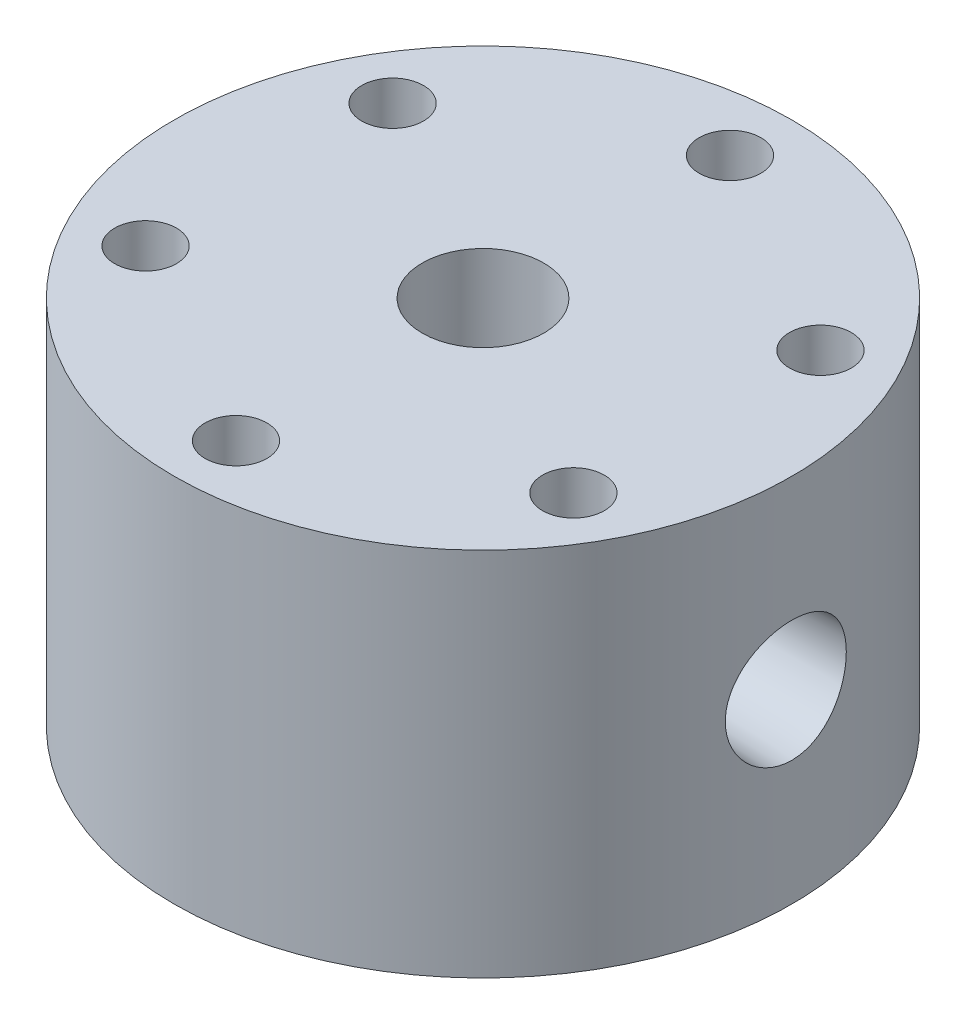
from build123d import *

# Parameters (mm, degrees)
M14X1_5_TAPPED_HOLE1_D              = 12.5
M14X1_5_TAPPED_HOLE1_DEPTH          = 25.4
M14X1_5_TAPPED_HOLE1_TIP            = 3.755378869
F_1_16_0_0625_DIAMETER_HOLE1_D      = 1.5875
F_1_16_0_0625_DIAMETER_HOLE1_DEPTH  = 28.575
F_1_16_0_0625_DIAMETER_HOLE1_TIP    = 0.476933116
F_3_32_0_09375_DIAMETER_HOLE1_D     = 2.38125
F_3_32_0_09375_DIAMETER_HOLE1_DEPTH = 28.702
F_3_32_0_09375_DIAMETER_HOLE1_TIP   = 0.715399675
F_1_4_0_25_DIAMETER_HOLE1_D         = 6.35
CIRPATTERN1_COUNT                   = 6
F_1_32_0_03125_DIAMETER_HOLE1_D     = 0.79375
F_1_32_0_03125_DIAMETER_HOLE1_DEPTH = 28.575
F_1_32_0_03125_DIAMETER_HOLE1_TIP   = 0.238466558


with BuildPart() as part:
    # Sketch1 → Revolve1 (revolve)
    with BuildSketch(Plane.XY, mode=Mode.PRIVATE) as revolve1_sk:
        Polygon((-12.7, 0), (-31.75, 0), (-31.75, 38.1), (-3.81, 38.1), (-3.81, 6.35), (-8.0645, 6.35), (-8.0645, 8.382), (-11.1125, 8.382), (-11.1125, 6.35), (-12.7, 6.35), align=None)
    revolve(revolve1_sk.sketch.rotate(Axis((0, 0, 0), (0, 1, 0)), 270), axis=Axis((0, 0, 0), (0, 1, 0)))

    # M14x1.5 Tapped Hole1
    with Locations(Plane(origin=(0, 38.1, 0), x_dir=(1, 0, 0), z_dir=(0, 1, 0))):
        with Locations((0, 0)):
            Hole(M14X1_5_TAPPED_HOLE1_D / 2, depth=M14X1_5_TAPPED_HOLE1_DEPTH)
            with Locations((0, 0, -(M14X1_5_TAPPED_HOLE1_DEPTH + M14X1_5_TAPPED_HOLE1_TIP / 2))):  # 118° drill point
                Cone(0, M14X1_5_TAPPED_HOLE1_D / 2, M14X1_5_TAPPED_HOLE1_TIP, mode=Mode.SUBTRACT)

    # Sketch6 → 1/4 NPT Tapped Hole1 (revolve, cut)
    with BuildSketch(Plane(origin=(31.75, 19.05, 0), x_dir=(0, 0, -1), z_dir=(0, 1, 0))):
        Polygon((0, 0), (0, 20.360347279), (5.5626, 17.018), (5.5626, 9.906), (5.943685794, 9.906), (6.2402847, 0), align=None)
    revolve(axis=Axis((38.1, 19.05, 0), (-1, 0, 0)), mode=Mode.SUBTRACT)

    # Sketch8 → 1/4 NPT Tapped Hole2 (revolve, cut)
    with BuildSketch(Plane(origin=(-31.75, 19.05, 0), x_dir=(0, 0, 1), z_dir=(0, 1, 0))):
        Polygon((0, 0), (0, 20.360347279), (5.5626, 17.018), (5.5626, 9.906), (5.943685794, 9.906), (6.2402847, 0), align=None)
    revolve(axis=Axis((-38.1, 19.05, 0), (1, 0, 0)), mode=Mode.SUBTRACT)

    # 1/16 (0.0625) Diameter Hole1
    with Locations(Plane(origin=(31.75, 0, 0), x_dir=(0, 0, -1), z_dir=(1, 0, 0))):
        with Locations((0, 19.05)):
            Hole(F_1_16_0_0625_DIAMETER_HOLE1_D / 2, depth=F_1_16_0_0625_DIAMETER_HOLE1_DEPTH)
            with Locations((0, 0, -(F_1_16_0_0625_DIAMETER_HOLE1_DEPTH + F_1_16_0_0625_DIAMETER_HOLE1_TIP / 2))):  # 118° drill point
                Cone(0, F_1_16_0_0625_DIAMETER_HOLE1_D / 2, F_1_16_0_0625_DIAMETER_HOLE1_TIP, mode=Mode.SUBTRACT)

    # 3/32 (0.09375) Diameter Hole1
    with Locations(Plane.ZY.offset(31.75)):
        with Locations((0, 19.05)):
            Hole(F_3_32_0_09375_DIAMETER_HOLE1_D / 2, depth=F_3_32_0_09375_DIAMETER_HOLE1_DEPTH)
            with Locations((0, 0, -(F_3_32_0_09375_DIAMETER_HOLE1_DEPTH + F_3_32_0_09375_DIAMETER_HOLE1_TIP / 2))):  # 118° drill point
                Cone(0, F_3_32_0_09375_DIAMETER_HOLE1_D / 2, F_3_32_0_09375_DIAMETER_HOLE1_TIP, mode=Mode.SUBTRACT)

    # 1/4 (0.25) Diameter Hole1 (through all)
    with Locations(Plane(origin=(0, 38.1, 0), x_dir=(1, 0, 0), z_dir=(0, 1, 0))):
        with Locations((21.997045256, 12.7)):
            f_1_4_0_25_diameter_hole1 = Hole(F_1_4_0_25_DIAMETER_HOLE1_D / 2)

    # CirPattern1: 1/4 (0.25) Diameter Hole1 ×6 about axis
    cirpattern1_axis = Axis((0, 0, 0), (0, 1, 0))
    for i in range(1, CIRPATTERN1_COUNT):
        add(f_1_4_0_25_diameter_hole1.rotate(cirpattern1_axis, i * 360 / CIRPATTERN1_COUNT), mode=Mode.SUBTRACT)

    # Sketch18 → 1/4 NPT Tapped Hole3 (revolve, cut)
    with BuildSketch(Plane(origin=(15.875, 19.05, -27.49630657), x_dir=(-0.8660254037844416, 0, -0.49999999999999495), z_dir=(0, 1, 0))):
        Polygon((0, 0), (0, 20.360347279), (5.5626, 17.018), (5.5626, 9.906), (5.943685794, 9.906), (6.2402847, 0), align=None)
    revolve(axis=Axis((19.05, 19.05, -32.995567884), (-0.49999999999999495, 0, 0.8660254037844417)), mode=Mode.SUBTRACT)

    # 1/32 (0.03125) Diameter Hole1
    with Locations(Plane(origin=(15.875, 0, -27.49630657), x_dir=(0, -1, 0), z_dir=(0.49999999999999495, 0, -0.8660254037844416))):
        with Locations((-19.05, 0)):
            Hole(F_1_32_0_03125_DIAMETER_HOLE1_D / 2, depth=F_1_32_0_03125_DIAMETER_HOLE1_DEPTH)
            with Locations((0, 0, -(F_1_32_0_03125_DIAMETER_HOLE1_DEPTH + F_1_32_0_03125_DIAMETER_HOLE1_TIP / 2))):  # 118° drill point
                Cone(0, F_1_32_0_03125_DIAMETER_HOLE1_D / 2, F_1_32_0_03125_DIAMETER_HOLE1_TIP, mode=Mode.SUBTRACT)


solid = part.part
